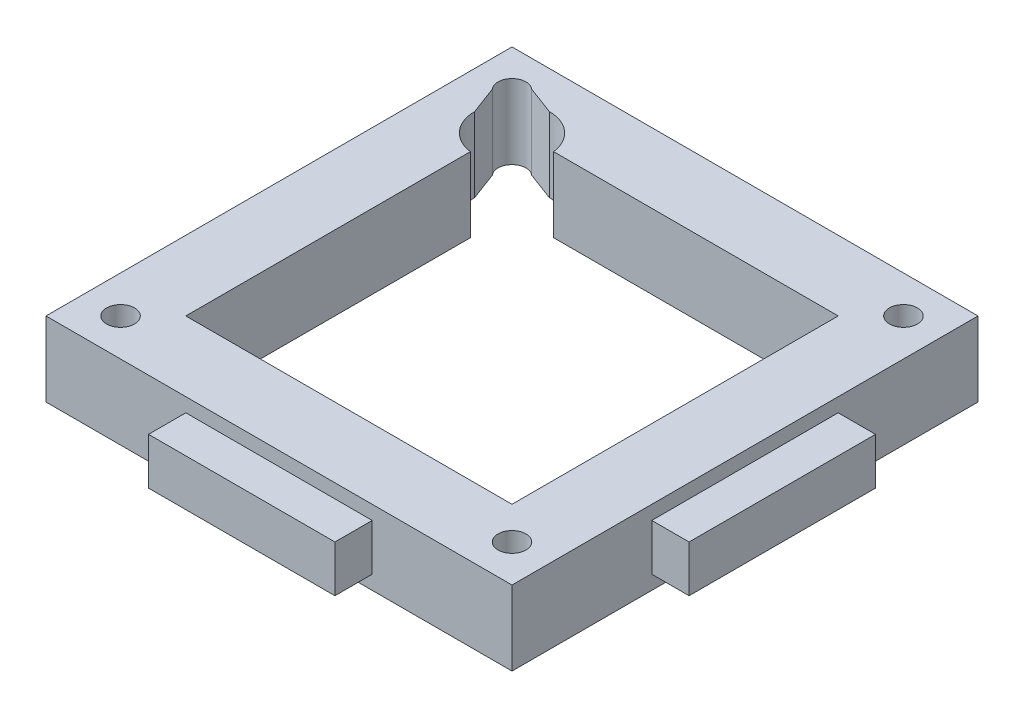
from build123d import *

# Parameters (mm, degrees)
SKETCH1_W         = 50
SKETCH1_H         = 50
SKETCH1_R         = 1.5
SUPPORT_DEPTH     = 8
SOUTH_START       = 25
SKETCH2_W         = 20
SKETCH2_H         = 5
SOUTH_DOWEL_DEPTH = 4
EAST_START        = 25
SKETCH3_W         = 20
SKETCH3_H         = 5
EAST_DOWEL_DEPTH  = 4
WEST_START        = -25
SKETCH3_2_W       = 20
SKETCH3_2_H       = 5
WEST_CUT_DEPTH    = 4


with BuildPart() as part:
    # Sketch1 → Support (new body)
    with BuildSketch(Plane(origin=(0, 0, 0), x_dir=(1, 0, 0), z_dir=(0, 1, 0))):
        Rectangle(SKETCH1_W, SKETCH1_H)
        with Locations(Location((-21, -21, 0), (0, 0, 270))):
            Circle(SKETCH1_R, mode=Mode.SUBTRACT)
        with Locations(Location((21, -21, 0), (0, 0, 270))):
            Circle(SKETCH1_R, mode=Mode.SUBTRACT)
        with BuildLine():
            Line((-13.031373033, 17.5), (17.5, 17.5))
            Line((17.5, 17.5), (17.5, -17.5))
            Line((17.5, -17.5), (-17.5, -17.5))
            Line((-17.5, -17.5), (-17.5, 13.031373033))
            ThreePointArc((-17.5, 13.031373033), (-20, 14.354248689), (-21, 17))
            Line((-21, 17), (-22.130136986, 20.01369863))
            ThreePointArc((-22.130136986, 20.01369863), (-22.060660172, 22.060660172), (-20.01369863, 22.130136986))
            Line((-20.01369863, 22.130136986), (-17, 21))
            ThreePointArc((-17, 21), (-14.354248689, 20), (-13.031373033, 17.5))
        make_face(mode=Mode.SUBTRACT)
        with Locations(Location((21, 21, 0), (0, 0, 270))):
            Circle(SKETCH1_R, mode=Mode.SUBTRACT)
    extrude(amount=SUPPORT_DEPTH)

    # Sketch2 → South Dowel (add)
    with BuildSketch(Plane.XY.offset(SOUTH_START)):
        with Locations((0, 4)):
            Rectangle(SKETCH2_W, SKETCH2_H)
    extrude(amount=SOUTH_DOWEL_DEPTH)

    # Sketch3 → East Dowel (add)
    with BuildSketch(Plane(origin=(0, 0, 0), x_dir=(0, 0, -1), z_dir=(1, 0, 0)).offset(EAST_START)):
        with Locations((0, 4)):
            Rectangle(SKETCH3_W, SKETCH3_H)
    extrude(amount=EAST_DOWEL_DEPTH)

    # Sketch3<2> → West Cut (cut)
    with BuildSketch(Plane(origin=(0, 0, 0), x_dir=(0, 0, -1), z_dir=(1, 0, 0)).offset(WEST_START)):
        with Locations((0, 4)):
            Rectangle(SKETCH3_2_W, SKETCH3_2_H)
    extrude(amount=WEST_CUT_DEPTH, mode=Mode.SUBTRACT)


solid = part.part
